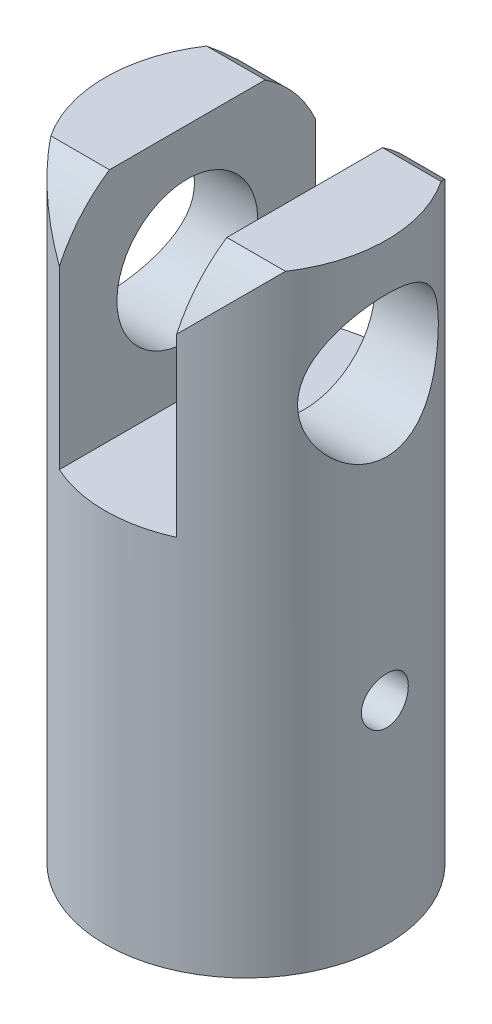
from build123d import *

# Parameters (mm, degrees)
SKETCH_1_R               = 3
EXTRUDE_1_DEPTH          = 11
SKETCH_2_R               = 1.5
CUT_EXTRUDE_1_DEPTH      = 5
CUT_EXTRUDE_2_DEPTH      = 12.789826123
CUT_EXTRUDE_2_DEPTH_BACK = 12.789826123
SKETCH_3_R               = 1.5
SKETCH_3_R_2             = 0.5
CUT_EXTRUDE_3_DEPTH      = 12.789826267
CUT_EXTRUDE_3_DEPTH_BACK = 12.789826267
SKETCH_4_W               = 2.5
SKETCH_4_H               = 5
EXTRUDE_START            = 2
SKETCH_5_R               = 3
SKETCH_5_R_2             = 1.5
EXTRUDE_2_DEPTH          = 2


with BuildPart() as part:
    # 草图1 → 凸台-拉伸1 (new body)
    with BuildSketch(Plane(origin=(0, 0, 0), x_dir=(1, 0, 0), z_dir=(0, 1, 0))):
        with Locations(Location((0, 0, 0), (0, 0, 270))):
            Circle(SKETCH_1_R)
    extrude(amount=EXTRUDE_1_DEPTH)

    # 草图2 → 切除-拉伸1 (cut)
    with BuildSketch(Plane.XZ):
        with Locations(Location((0, 0, 0), (0, 0, 270))):
            Circle(SKETCH_2_R)
    extrude(amount=-CUT_EXTRUDE_1_DEPTH, mode=Mode.SUBTRACT)

    # 草图3 → 切除-拉伸2 (cut, two sides: drawn at the far end of the back side and taken through both)
    with BuildSketch(Plane(origin=(0, 0, 0), x_dir=(0, 0, -1), z_dir=(1, 0, 0)).offset(-CUT_EXTRUDE_2_DEPTH_BACK)):
        with Locations((0, 8.5)):
            Circle(SKETCH_3_R)
        with Locations((0, 2.5)):
            Circle(SKETCH_3_R_2)
        with BuildLine():
            Line((-3, 8.5), (-3, 11))
            Line((-3, 11), (-1.658168408, 11.000095504))
            ThreePointArc((-1.658168408, 11.000095504), (-2.643341183, 9.918713286), (-3, 8.5))
        make_face()
        with BuildLine():
            Line((1.658168408, 11.000095504), (3, 11))
            Line((3, 11), (3, 8.5))
            ThreePointArc((3, 8.5), (2.643341183, 9.918713286), (1.658168408, 11.000095504))
        make_face()
    extrude(amount=CUT_EXTRUDE_2_DEPTH + CUT_EXTRUDE_2_DEPTH_BACK, mode=Mode.SUBTRACT)

    # 草图4 → 切除-拉伸3 (cut, two sides: drawn at the far end of the back side and taken through both)
    with BuildSketch(Plane.XY.offset(-CUT_EXTRUDE_3_DEPTH_BACK)):
        with Locations((0, 8.5)):
            Rectangle(SKETCH_4_W, SKETCH_4_H)
    extrude(amount=CUT_EXTRUDE_3_DEPTH + CUT_EXTRUDE_3_DEPTH_BACK, mode=Mode.SUBTRACT)

    # 草图5 → 凸台-拉伸2 (add)
    with BuildSketch(Plane.XZ.offset(EXTRUDE_START)):
        with Locations(Location((0, 0, 0), (0, 0, 270))):
            Circle(SKETCH_5_R)
        with Locations(Location((0, 0, 0), (0, 0, 270))):
            Circle(SKETCH_5_R_2, mode=Mode.SUBTRACT)
    extrude(amount=-EXTRUDE_2_DEPTH)


solid = part.part
